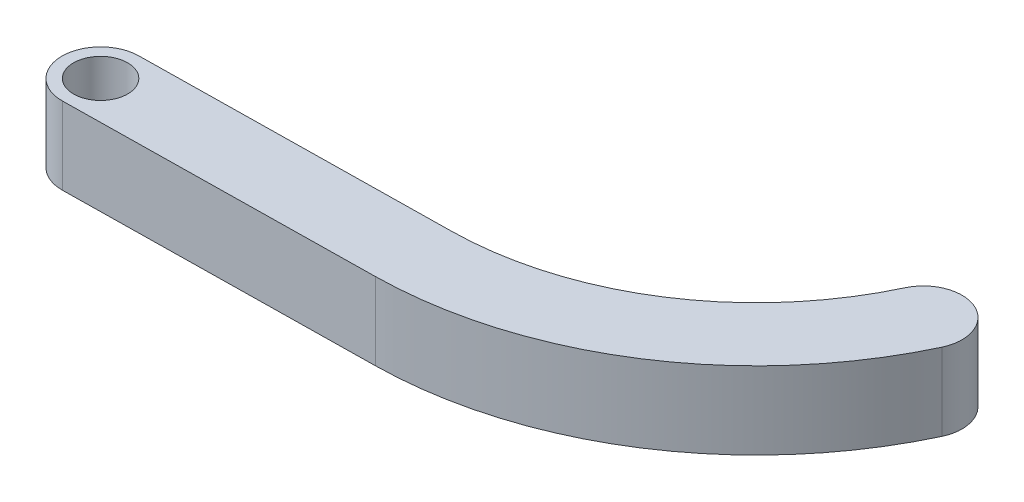
from build123d import *

# Parameters (mm, degrees)
SKETCH1_R           = 2.2225
BOSS_EXTRUDE1_DEPTH = 6.35


with BuildPart() as part:
    # Sketch1 → Boss-Extrude1 (new body)
    with BuildSketch(Plane(origin=(0, 0, 0), x_dir=(1, 0, 0), z_dir=(0, 1, 0))):
        with BuildLine():
            Line((-0.046089406, 3.174665457), (25.307821187, 3.542750442))
            ThreePointArc((25.307821187, 3.542750442), (38.709203085, 7.5965874), (47.926567326, 18.135601931))
            ThreePointArc((47.926567326, 18.135601931), (52.150559021, 19.658475583), (53.673432674, 15.434483888))
            ThreePointArc((53.673432674, 15.434483888), (42.151727371, 2.260715725), (25.4, -2.806580473))
            Line((25.4, -2.806580473), (0.046089406, -3.174665457))
            ThreePointArc((0.046089406, -3.174665457), (-3.174665457, -0.046089406), (-0.046089406, 3.174665457))
        make_face()
        with Locations(Location((0, 0, 0), (0, 0, 270))):
            Circle(SKETCH1_R, mode=Mode.SUBTRACT)
    extrude(amount=BOSS_EXTRUDE1_DEPTH)


solid = part.part
